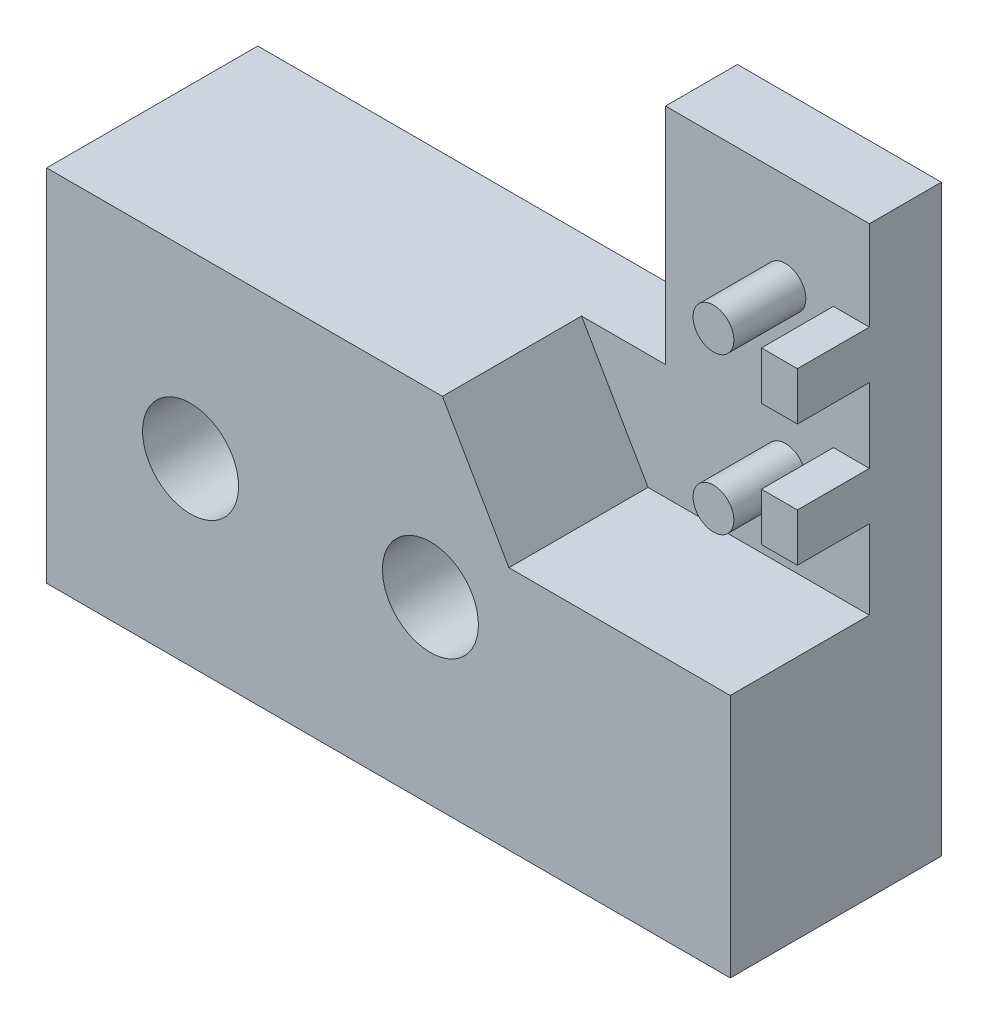
from build123d import *

# Parameters (mm, degrees)
EXTRUDE_1_DEPTH     = 3
EXTRUDE_2_DEPTH     = 5.8
SKETCH_3_W          = 1.5
SKETCH_3_H          = 2
SKETCH_3_R          = 0.85
EXTRUDE_3_DEPTH     = 3
CUT_EXTRUDE_1_DEPTH = 8.8


with BuildPart() as part:
    # 草图1 → 凸台-拉伸1 (new body)
    with BuildSketch(Plane.XY):
        Polygon((0, 0), (-28.5, 0), (-28.5, 15), (-8.5, 15), (-8.5, 24.333), (0, 24.333), align=None)
    extrude(amount=EXTRUDE_1_DEPTH)

    # 草图2 → 凸台-拉伸2 (add)
    with BuildSketch(Plane.XY.offset(3)):
        Polygon((-12, 15), (-9.228718708, 10.2), (0, 10.2), (0, 0), (-28.5, 0), (-28.5, 15), align=None)
    extrude(amount=EXTRUDE_2_DEPTH)

    # 草图3 → 凸台-拉伸3 (add)
    with BuildSketch(Plane.XY.offset(3)):
        with Locations((-0.75, 19.6)):
            Rectangle(SKETCH_3_W, SKETCH_3_H)
        with Locations((-0.75, 14.5)):
            Rectangle(SKETCH_3_W, SKETCH_3_H)
        with Locations(Location((-3.5, 13.8, 0), (0, 0, 180))):
            Circle(SKETCH_3_R)
        with Locations(Location((-3.5, 20.3, 0), (0, 0, 180))):
            Circle(SKETCH_3_R)
    extrude(amount=EXTRUDE_3_DEPTH)

    # 草图5 → 切除-拉伸1 (cut)
    with BuildSketch(Plane.XY.offset(8.8)):
        with BuildLine():
            ThreePointArc((-20.5, 7.5), (-22.5, 9.5), (-24.5, 7.5))
            Line((-24.5, 7.5), (-20.5, 7.5))
        make_face()
        with BuildLine():
            Line((-20.5, 7.5), (-24.5, 7.5))
            ThreePointArc((-24.5, 7.5), (-22.5, 5.5), (-20.5, 7.5))
        make_face()
        with BuildLine():
            ThreePointArc((-10.5, 7.5), (-12.5, 9.5), (-14.5, 7.5))
            Line((-14.5, 7.5), (-10.5, 7.5))
        make_face()
        with BuildLine():
            Line((-10.5, 7.5), (-14.5, 7.5))
            ThreePointArc((-14.5, 7.5), (-12.5, 5.5), (-10.5, 7.5))
        make_face()
    extrude(amount=-CUT_EXTRUDE_1_DEPTH, mode=Mode.SUBTRACT)


solid = part.part
